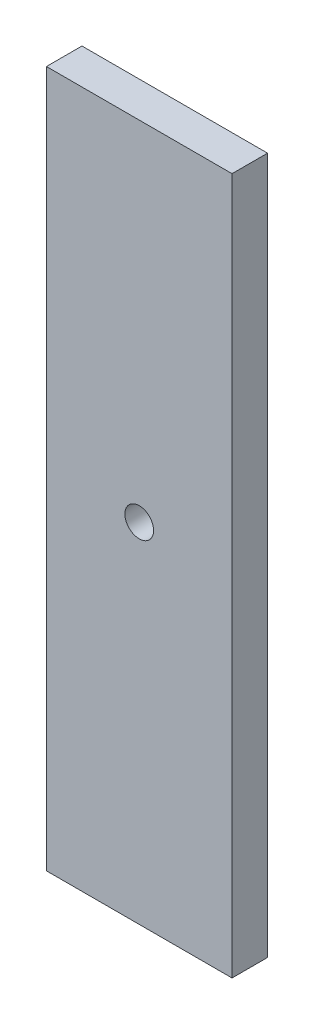
from build123d import *

# Parameters (mm, degrees)
SKETCH1_W           = 14.6
SKETCH1_H           = 54.8
SKETCH1_R           = 1.129374754
BOSS_EXTRUDE1_DEPTH = 2.794


with BuildPart() as part:
    # Sketch1 → Boss-Extrude1 (new body)
    with BuildSketch(Plane.XY):
        with Locations((-40, 28.75)):
            Rectangle(SKETCH1_W, SKETCH1_H)
        with Locations((-40, 28.75)):
            Circle(SKETCH1_R, mode=Mode.SUBTRACT)
    extrude(amount=BOSS_EXTRUDE1_DEPTH)


solid = part.part
